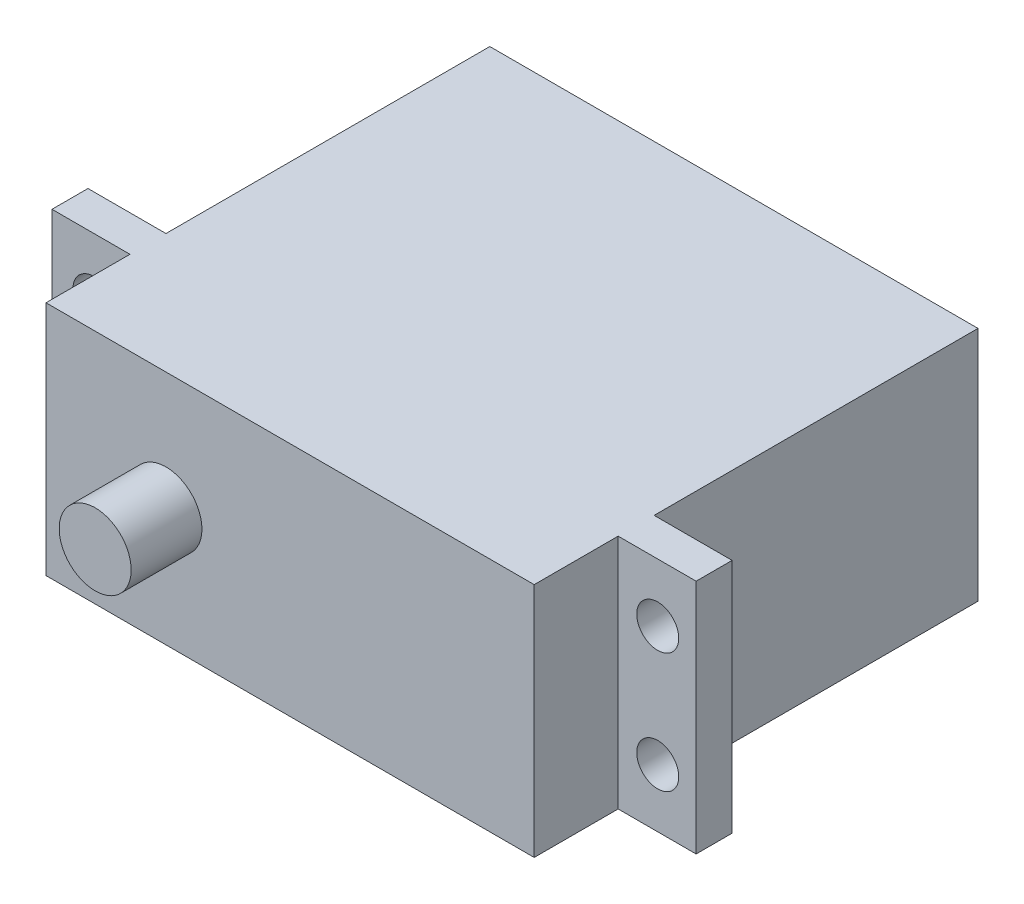
from build123d import *

# Parameters (mm, degrees)
CASE_40P7X19P7_START                 = -30
CASE_40P7X19P7_PROFILE_W             = 40.7
CASE_40P7X19P7_PROFILE_H             = 19.7
CASE_40P7X19P7_DEPTH                 = 37
MOUNTING_FLANGE_NOMINAL_START        = -3
MOUNTING_FLANGE_NOMINAL_PROFILE_W    = 53.7
MOUNTING_FLANGE_NOMINAL_PROFILE_H    = 19.7
MOUNTING_FLANGE_NOMINAL_DEPTH        = 3
OUTPUT_ENVELOPE_NOT_SPLINE_START     = 7
OUTPUT_ENVELOPE_NOT_SPLINE_PROFILE_R = 3
OUTPUT_ENVELOPE_NOT_SPLINE_DEPTH     = 5.9
TAB_HOLES_NOMINAL_START              = -50
TAB_HOLES_NOMINAL_PROFILE_R          = 1.75
TAB_HOLES_NOMINAL_DEPTH              = 99.794082633


with BuildPart() as part:
    # Case_40p7x19p7_profile → Case_40p7x19p7 (new body)
    with BuildSketch(Plane.XY.offset(CASE_40P7X19P7_START)):
        with Locations((10.35, 0)):
            Rectangle(CASE_40P7X19P7_PROFILE_W, CASE_40P7X19P7_PROFILE_H)
    extrude(amount=CASE_40P7X19P7_DEPTH)

    # Mounting_flange_nominal_profile → Mounting_flange_nominal (add)
    with BuildSketch(Plane.XY.offset(MOUNTING_FLANGE_NOMINAL_START)):
        with Locations((10.35, 0)):
            Rectangle(MOUNTING_FLANGE_NOMINAL_PROFILE_W, MOUNTING_FLANGE_NOMINAL_PROFILE_H)
    extrude(amount=MOUNTING_FLANGE_NOMINAL_DEPTH)

    # Output_envelope_not_spline_profile → Output_envelope_not_spline (add)
    with BuildSketch(Plane.XY.offset(OUTPUT_ENVELOPE_NOT_SPLINE_START)):
        Circle(OUTPUT_ENVELOPE_NOT_SPLINE_PROFILE_R)
    extrude(amount=OUTPUT_ENVELOPE_NOT_SPLINE_DEPTH)

    # Tab_holes_nominal_profile → Tab_holes_nominal (cut, through all)
    with BuildSketch(Plane.XY.offset(TAB_HOLES_NOMINAL_START)):
        with Locations(Location((-13, 5, 0), (0, 0, 180))):
            Circle(TAB_HOLES_NOMINAL_PROFILE_R)
        with Locations(Location((-13, -5, 0), (0, 0, 180))):
            Circle(TAB_HOLES_NOMINAL_PROFILE_R)
        with Locations(Location((34, 5, 0), (0, 0, 180))):
            Circle(TAB_HOLES_NOMINAL_PROFILE_R)
        with Locations(Location((34, -5, 0), (0, 0, 180))):
            Circle(TAB_HOLES_NOMINAL_PROFILE_R)
    extrude(amount=TAB_HOLES_NOMINAL_DEPTH, mode=Mode.SUBTRACT)


solid = part.part
